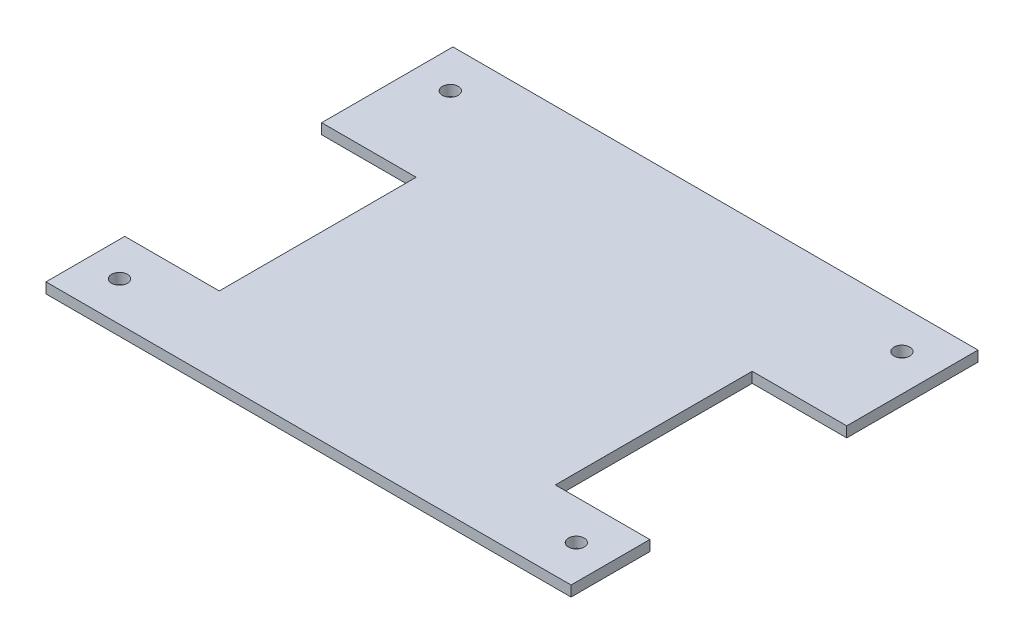
from build123d import *

# Parameters (mm, degrees)
SKETCH1_R           = 3
BOSS_EXTRUDE1_DEPTH = 4


with BuildPart() as part:
    # Sketch1 → Boss-Extrude1 (new body)
    with BuildSketch(Plane(origin=(0, 0, 0), x_dir=(1, 0, 0), z_dir=(0, 1, 0))):
        Polygon((-128.41728333, -2.6724492), (-92.41728333, -2.6724492), (-92.41728333, -77.6724492), (-128.41728333, -77.6724492), (-128.41728333, -107.6724492), (71.58271667, -107.6724492), (71.58271667, -77.6724492), (35.58271667, -77.6724492), (35.58271667, -2.6724492), (71.58271667, -2.6724492), (71.58271667, 47.3275508), (-128.41728333, 47.3275508), align=None)
        with Locations(Location((-115.41728333, -92.6724492, 0), (0, 0, 270))):
            Circle(SKETCH1_R, mode=Mode.SUBTRACT)
        with Locations(Location((58.58271667, -92.6724492, 0), (0, 0, 90))):
            Circle(SKETCH1_R, mode=Mode.SUBTRACT)
        with Locations(Location((-114.41728333, 32.3275508, 0), (0, 0, 270))):
            Circle(SKETCH1_R, mode=Mode.SUBTRACT)
        with Locations(Location((57.58271667, 32.3275508, 0), (0, 0, 90))):
            Circle(SKETCH1_R, mode=Mode.SUBTRACT)
    extrude(amount=BOSS_EXTRUDE1_DEPTH)


solid = part.part
